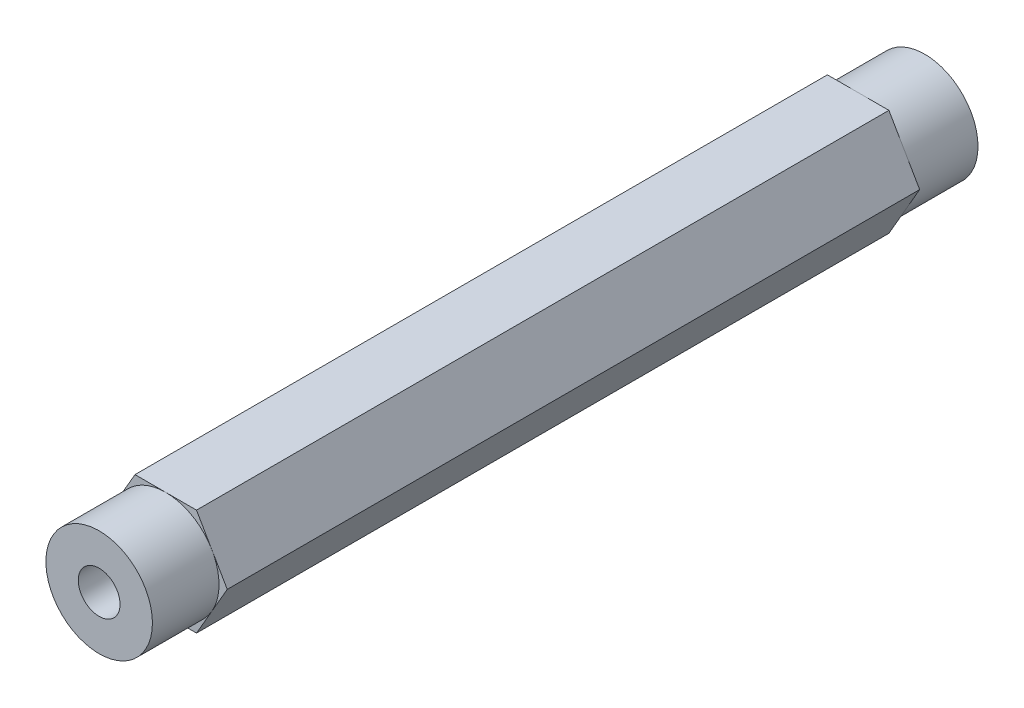
from build123d import *

# Parameters (mm, degrees)
SKETCH1_R           = 2.4892
BOSS_EXTRUDE1_DEPTH = 49.2125
SKETCH2_OUTSIDE_W   = 36.728
SKETCH2_OUTSIDE_H   = 34.764
SKETCH2_OUTSIDE_R   = 6.35
CUT_EXTRUDE1_DEPTH  = 7.9375


with BuildPart() as part:
    # Sketch1 → Boss-Extrude1 (new, symmetric)
    with BuildSketch(Plane.XY):
        Polygon((3.666174209, 6.35), (-3.666174209, 6.35), (-7.332348419, 0), (-3.666174209, -6.35), (3.666174209, -6.35), (7.332348419, 0), align=None)
        Circle(SKETCH1_R, mode=Mode.SUBTRACT)
    extrude(amount=BOSS_EXTRUDE1_DEPTH, both=True)

    # Sketch2 outside → Cut-Extrude1 (cut)
    with BuildSketch(Plane.XY.offset(49.2125)):
        Rectangle(SKETCH2_OUTSIDE_W, SKETCH2_OUTSIDE_H)
        Circle(SKETCH2_OUTSIDE_R, mode=Mode.SUBTRACT)
    cut_extrude1 = extrude(amount=-CUT_EXTRUDE1_DEPTH, mode=Mode.SUBTRACT)

    # Mirror1: Cut-Extrude1 across plane
    add(cut_extrude1.mirror(Plane.XY), mode=Mode.SUBTRACT)


solid = part.part
